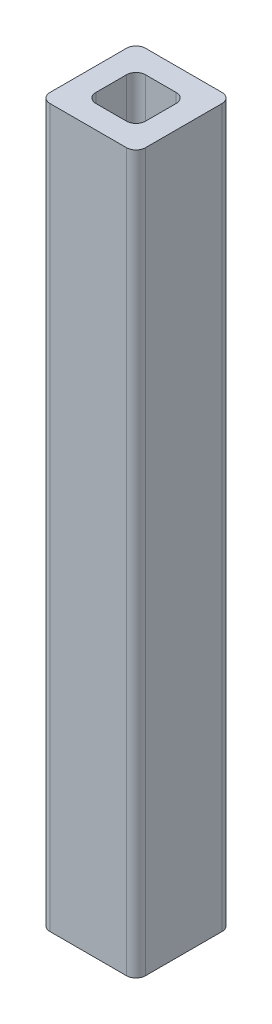
from build123d import *

# Parameters (mm, degrees)
EXTRUDE_1_DEPTH     = 75
CUT_EXTRUDE_1_DEPTH = 5


with BuildPart() as part:
    # ｽｹｯﾁ1 → ﾎﾞｽ - 押し出し1 (new body)
    with BuildSketch(Plane(origin=(0, 0, 0), x_dir=(1, 0, 0), z_dir=(0, 1, 0))):
        with BuildLine():
            Line((-4, -5), (4, -5))
            ThreePointArc((4, -5), (4.707106781, -4.707106781), (5, -4))
            Line((5, -4), (5, 4))
            ThreePointArc((5, 4), (4.707106781, 4.707106781), (4, 5))
            Line((4, 5), (-4, 5))
            ThreePointArc((-4, 5), (-4.707106781, 4.707106781), (-5, 4))
            Line((-5, 4), (-5, -4))
            ThreePointArc((-5, -4), (-4.707106781, -4.707106781), (-4, -5))
        make_face()
    extrude(amount=EXTRUDE_1_DEPTH)

    # ｽｹｯﾁ2 → ｶｯﾄ - 押し出し1 (cut)
    with BuildSketch(Plane(origin=(0, 75, 0), x_dir=(1, 0, 0), z_dir=(0, 1, 0))):
        with BuildLine():
            Line((-1.6, -2.6), (1.6, -2.6))
            ThreePointArc((1.6, -2.6), (2.307106781, -2.307106781), (2.6, -1.6))
            Line((2.6, -1.6), (2.6, 1.6))
            ThreePointArc((2.6, 1.6), (2.307106781, 2.307106781), (1.6, 2.6))
            Line((1.6, 2.6), (-1.6, 2.6))
            ThreePointArc((-1.6, 2.6), (-2.307106781, 2.307106781), (-2.6, 1.6))
            Line((-2.6, 1.6), (-2.6, -1.6))
            ThreePointArc((-2.6, -1.6), (-2.307106781, -2.307106781), (-1.6, -2.6))
        make_face()
    extrude(amount=-CUT_EXTRUDE_1_DEPTH, mode=Mode.SUBTRACT)


solid = part.part
